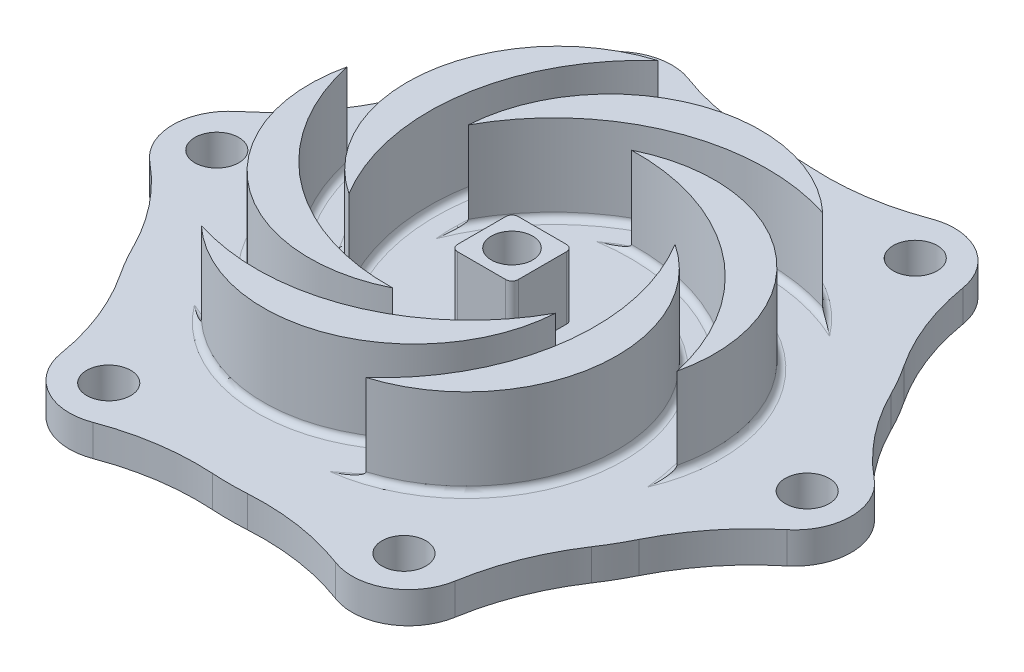
from build123d import *

# Parameters (mm, degrees)
SKETCH1_R                = 25.4
BOSS_EXTRUDE1_DEPTH      = 3.175
SKETCH2_R                = 28.575
SKETCH2_R_2              = 25.4
BOSS_EXTRUDE2_DEPTH      = 3.175
SKETCH4_R                = 2.0955
BOSS_EXTRUDE3_DEPTH      = 6.35
CUT_EXTRUDE1_DEPTH       = 41.907013457
CUT_EXTRUDE1_DEPTH_BACK  = 41.907013457
SKETCH5_R                = 2.0955
BOSS_EXTRUDE4_DEPTH      = 8.89
FILLET1_R                = 0.635
CIRPATTERN1_COUNT        = 6
FILLET1_OF_CIRPATTERN1_R = 0.635
BOSS_EXTRUDE6_START      = -3.175
BOSS_EXTRUDE6_DEPTH      = 3.175
FILLET4_R                = 25.4
SKETCH9_R                = 2.2225
CUT_EXTRUDE2_DEPTH       = 46.512271286
CIRPATTERN3_COUNT        = 6
FILLET4_OF_CIRPATTERN3_R = 25.4


with BuildPart() as part:
    # Sketch1 → Boss-Extrude1 (new body)
    with BuildSketch(Plane(origin=(0, 0, 0), x_dir=(1, 0, 0), z_dir=(0, 1, 0))):
        with Locations(Location((0, 0, 0), (0, 0, 270))):
            Circle(SKETCH1_R)
    extrude(amount=BOSS_EXTRUDE1_DEPTH)

    # Sketch2 → Boss-Extrude2 (add)
    with BuildSketch(Plane(origin=(0, 0, 0), x_dir=(-1, 0, 0), z_dir=(0, -1, 0))):
        with Locations(Location((0, 0, 0), (0, 0, 90))):
            Circle(SKETCH2_R)
        Circle(SKETCH2_R_2, mode=Mode.SUBTRACT)
    extrude(amount=-BOSS_EXTRUDE2_DEPTH)

    # Sketch4 → Boss-Extrude3 (add)
    with BuildSketch(Plane(origin=(0, 3.175, 0), x_dir=(1, 0, 0), z_dir=(0, 1, 0))):
        with BuildLine():
            Line((-2.4384, 3.0734), (2.4384, 3.0734))
            ThreePointArc((2.4384, 3.0734), (2.887412806, 2.887412806), (3.0734, 2.4384))
            Line((3.0734, 2.4384), (3.0734, -2.4384))
            ThreePointArc((3.0734, -2.4384), (2.887412806, -2.887412806), (2.4384, -3.0734))
            Line((2.4384, -3.0734), (-2.4384, -3.0734))
            ThreePointArc((-2.4384, -3.0734), (-2.887412806, -2.887412806), (-3.0734, -2.4384))
            Line((-3.0734, -2.4384), (-3.0734, 2.4384))
            ThreePointArc((-3.0734, 2.4384), (-2.887412806, 2.887412806), (-2.4384, 3.0734))
        make_face()
        with Locations(Location((0, 0, 0), (0, 0, 270))):
            Circle(SKETCH4_R, mode=Mode.SUBTRACT)
    extrude(amount=BOSS_EXTRUDE3_DEPTH)

    # Sketch5 → Cut-Extrude1 (cut, two sides: drawn at the far end of the back side and taken through both)
    with BuildSketch(Plane(origin=(0, 3.175, 0), x_dir=(1, 0, 0), z_dir=(0, 1, 0)).offset(-CUT_EXTRUDE1_DEPTH_BACK)):
        with Locations(Location((0, 0, 0), (0, 0, 270))):
            Circle(SKETCH5_R)
    extrude(amount=CUT_EXTRUDE1_DEPTH + CUT_EXTRUDE1_DEPTH_BACK, mode=Mode.SUBTRACT)

    # Sketch6 → Boss-Extrude4 (add)
    with BuildSketch(Plane(origin=(0, 3.175, 0), x_dir=(1, 0, 0), z_dir=(0, 1, 0))):
        with BuildLine():
            ThreePointArc((-10.448596497, 6.0325), (-0.887552118, 19.262454028), (15.156234587, 16.255435342))
            ThreePointArc((15.156234587, 16.255435342), (0.509562672, 15.763176471), (-10.448596497, 6.0325))
        make_face()
    boss_extrude4 = extrude(amount=BOSS_EXTRUDE4_DEPTH)

    # Fillet1
    fillet1_edges = [part.edges().sort_by_distance(p)[0] for p in [
        (-0.887552118, 3.175, -19.262454028),
        (0.509562672, 3.175, -15.763176471),
    ]]
    fillet(fillet1_edges, radius=FILLET1_R)

    # CirPattern1: Boss-Extrude4 ×6 about axis
    cirpattern1_axis = Axis((0, 0, 0), (0, 1, 0))
    for i in range(1, CIRPATTERN1_COUNT):
        add(boss_extrude4.rotate(cirpattern1_axis, i * 360 / CIRPATTERN1_COUNT))

    # Fillet1 of CirPattern1
    fillet1_of_cirpattern1_edges = [part.edges().sort_by_distance(p)[0] for p in [
        (-17.125550586, 3.175, -8.862584333),
        (-13.396529932, 3.175, -8.322882455),
        (-16.237998469, 3.175, 10.399869695),
        (-13.906092605, 3.175, 7.440294016),
        (0.887552118, 3.175, 19.262454028),
        (-0.509562672, 3.175, 15.763176471),
        (17.125550586, 3.175, 8.862584333),
        (13.396529932, 3.175, 8.322882455),
        (16.237998469, 3.175, -10.399869695),
        (13.906092605, 3.175, -7.440294016),
    ]]
    fillet(fillet1_of_cirpattern1_edges, radius=FILLET1_OF_CIRPATTERN1_R)

    # Sketch8 → Boss-Extrude6 (add)
    with BuildSketch(Plane(origin=(0, 3.175, 0), x_dir=(1, 0, 0), z_dir=(0, 1, 0)).offset(BOSS_EXTRUDE6_START)):
        with BuildLine():
            ThreePointArc((-28.0035, 5.686353203), (-34.29, 0), (-28.0035, -5.686353203))
            ThreePointArc((-28.0035, -5.686353203), (-28.575, 0), (-28.0035, 5.686353203))
        make_face()
    boss_extrude6 = extrude(amount=BOSS_EXTRUDE6_DEPTH)

    # Fillet4
    fillet4_edges = [part.edges().sort_by_distance(p)[0] for p in [
        (-28.0035, 1.5875, -5.686353203),
        (-28.0035, 1.5875, 5.686353203),
    ]]
    fillet(fillet4_edges, radius=FILLET4_R)

    # Sketch9 → Cut-Extrude2 (cut, symmetric)
    with BuildSketch(Plane(origin=(0, 3.175, 0), x_dir=(1, 0, 0), z_dir=(0, 1, 0))):
        with Locations(Location((-29.845, 0, 0), (0, 0, 270))):
            Circle(SKETCH9_R)
    cut_extrude2 = extrude(amount=CUT_EXTRUDE2_DEPTH, both=True, mode=Mode.SUBTRACT)

    # CirPattern3: Boss-Extrude6, Cut-Extrude2 ×6 about axis
    cirpattern3_axis = Axis((0, 0, 0), (0, 1, 0))
    add([boss_extrude6.rotate(cirpattern3_axis, i * 360 / CIRPATTERN3_COUNT) for i in range(1, CIRPATTERN3_COUNT)])
    add([cut_extrude2.rotate(cirpattern3_axis, i * 360 / CIRPATTERN3_COUNT) for i in range(1, CIRPATTERN3_COUNT)], mode=Mode.SUBTRACT)

    # Fillet4 of CirPattern3
    fillet4_of_cirpattern3_edges = [part.edges().sort_by_distance(p)[0] for p in [
        (-18.926276329, 1.5875, 21.408565793),
        (-9.077223671, 1.5875, 27.094918996),
        (9.077223671, 1.5875, 27.094918996),
        (18.926276329, 1.5875, 21.408565793),
        (28.0035, 1.5875, 5.686353203),
        (28.0035, 1.5875, -5.686353203),
        (18.926276329, 1.5875, -21.408565793),
        (9.077223671, 1.5875, -27.094918996),
        (-9.077223671, 1.5875, -27.094918996),
        (-18.926276329, 1.5875, -21.408565793),
    ]]
    fillet(fillet4_of_cirpattern3_edges, radius=FILLET4_OF_CIRPATTERN3_R)


solid = part.part
